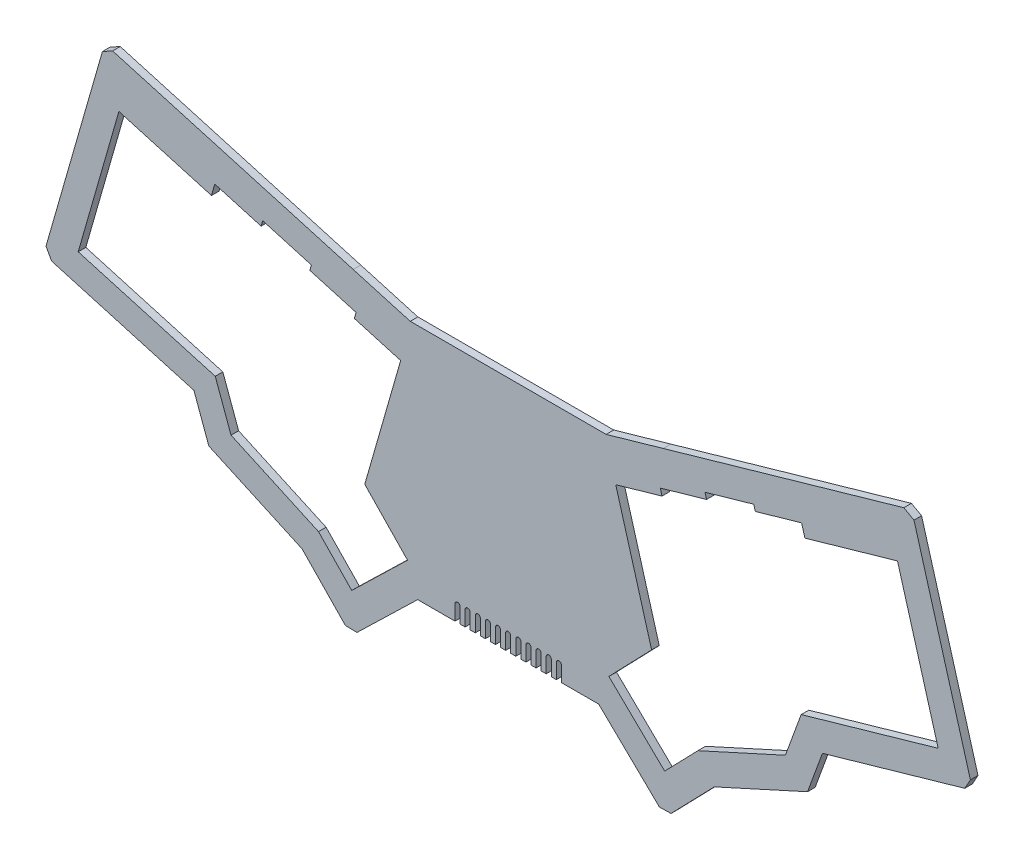
from build123d import *

# Parameters (mm, degrees)
BOSS_EXTRU_1_DEPTH      = 3
ENL_V_MAT_EXTRU_1_DEPTH = 10


with BuildPart() as part:
    # Esquisse1 → Boss.-Extru.1 (new body)
    with BuildSketch(Plane.XY):
        Polygon((-129.143746737, -14.701531345), (-206.446773007, -14.701531345), (-222.237416003, -10.173637327), (-228.962816583, -8.245159743), (-323.901077775, 18.972234266), (-327.912092601, 16.748746626), (-350.173506381, -60.88602933), (-347.950273, -64.896848521), (-291.80662177, -80.995781451), (-285.908889082, -97.08692424), (-249.107067355, -113.823629959), (-232.032352152, -131.457901649), (-227.449883961, -131.529994355), (-203.511236428, -108.350948678), (-132.079283315, -108.350948678), (-108.140635782, -131.529994355), (-103.558167591, -131.457901649), (-86.483452388, -113.823629959), (-49.681630661, -97.08692424), (-43.783897973, -80.995781451), (12.359753257, -64.896848521), (14.582986638, -60.88602933), (-7.678427142, 16.748746626), (-11.689441968, 18.972234266), (-106.627703159, -8.245159743), (-113.35310374, -10.173637327), align=None)
        Polygon((-128.0696158, -96.878899722), (-106.057456456, -118.225792128), (-92.935433745, -104.673746846), (-58.425639792, -88.979407851), (-52.188593581, -71.96249534), (1.870889973, -56.461187875), (-14.186085737, -0.463858857), (-50.716621092, -10.938821309), (-52.025991399, -6.372504389), (-70.291259076, -11.609985616), (-70.910965859, -9.448811229), (-90.137733677, -14.960840928), (-89.517720268, -17.123084647), (-107.782987945, -22.360565873), (-107.093845678, -24.763890567), (-125.358331696, -30.001147656), (-111.200088958, -79.377961929), (-127.377713529, -96.161100182), align=None, mode=Mode.SUBTRACT)
        Polygon((-224.390430785, -79.377961929), (-208.212806214, -96.161100182), (-207.491865187, -96.85509979), (-208.236606037, -97.572971364), (-229.533063287, -118.225792128), (-242.655085998, -104.673746846), (-277.164879951, -88.979407851), (-283.401926162, -71.96249534), (-337.461409717, -56.461187875), (-321.404434006, -0.463858857), (-284.873898651, -10.938821309), (-283.564528345, -6.372504389), (-265.299260667, -11.609985616), (-264.679553884, -9.448811229), (-245.452786066, -14.960840928), (-246.072799476, -17.123084647), (-227.807531798, -22.360565873), (-228.496674065, -24.763890567), (-210.232188047, -30.001147656), align=None, mode=Mode.SUBTRACT)
    extrude(amount=BOSS_EXTRU_1_DEPTH)

    # Esquisse2 → Enlèv. mat.-Extru.1 (cut)
    with BuildSketch(Plane.XY.offset(3)):
        with BuildLine():
            Line((-168.795259872, -108.350948678), (-168.795259872, -102.350948678))
            ThreePointArc((-168.795259872, -102.350948678), (-167.795259872, -101.350948678), (-166.795259872, -102.350948678))
            Line((-166.795259872, -102.350948678), (-166.795259872, -108.350948678))
            ThreePointArc((-166.795259872, -108.350948678), (-167.795259872, -109.350948678), (-168.795259872, -108.350948678))
        make_face()
        with BuildLine():
            Line((-164.795259872, -108.350948678), (-164.795259872, -102.350948678))
            ThreePointArc((-164.795259872, -102.350948678), (-163.795259872, -101.350948678), (-162.795259872, -102.350948678))
            Line((-162.795259872, -102.350948678), (-162.795259872, -108.350948678))
            ThreePointArc((-162.795259872, -108.350948678), (-163.795259872, -109.350948678), (-164.795259872, -108.350948678))
        make_face()
        with BuildLine():
            Line((-160.795259872, -108.350948678), (-160.795259872, -102.350948678))
            ThreePointArc((-160.795259872, -102.350948678), (-159.795259872, -101.350948678), (-158.795259872, -102.350948678))
            Line((-158.795259872, -102.350948678), (-158.795259872, -108.350948678))
            ThreePointArc((-158.795259872, -108.350948678), (-159.795259872, -109.350948678), (-160.795259872, -108.350948678))
        make_face()
        with BuildLine():
            Line((-156.795259872, -108.350948678), (-156.795259872, -102.350948678))
            ThreePointArc((-156.795259872, -102.350948678), (-155.795259872, -101.350948678), (-154.795259872, -102.350948678))
            Line((-154.795259872, -102.350948678), (-154.795259872, -108.350948678))
            ThreePointArc((-154.795259872, -108.350948678), (-155.795259872, -109.350948678), (-156.795259872, -108.350948678))
        make_face()
        with BuildLine():
            Line((-152.795259872, -108.350948678), (-152.795259872, -102.350948678))
            ThreePointArc((-152.795259872, -102.350948678), (-151.795259872, -101.350948678), (-150.795259872, -102.350948678))
            Line((-150.795259872, -102.350948678), (-150.795259872, -108.350948678))
            ThreePointArc((-150.795259872, -108.350948678), (-151.795259872, -109.350948678), (-152.795259872, -108.350948678))
        make_face()
        with BuildLine():
            Line((-148.795259872, -108.350948678), (-148.795259872, -102.350948678))
            ThreePointArc((-148.795259872, -102.350948678), (-147.795259872, -101.350948678), (-146.795259872, -102.350948678))
            Line((-146.795259872, -102.350948678), (-146.795259872, -108.350948678))
            ThreePointArc((-146.795259872, -108.350948678), (-147.795259872, -109.350948678), (-148.795259872, -108.350948678))
        make_face()
        with BuildLine():
            Line((-172.795259872, -108.350948678), (-172.795259872, -102.350948678))
            ThreePointArc((-172.795259872, -102.350948678), (-171.795259872, -101.350948678), (-170.795259872, -102.350948678))
            Line((-170.795259872, -102.350948678), (-170.795259872, -108.350948678))
            ThreePointArc((-170.795259872, -108.350948678), (-171.795259872, -109.350948678), (-172.795259872, -108.350948678))
        make_face()
        with BuildLine():
            Line((-176.795259872, -108.350948678), (-176.795259872, -102.350948678))
            ThreePointArc((-176.795259872, -102.350948678), (-175.795259872, -101.350948678), (-174.795259872, -102.350948678))
            Line((-174.795259872, -102.350948678), (-174.795259872, -108.350948678))
            ThreePointArc((-174.795259872, -108.350948678), (-175.795259872, -109.350948678), (-176.795259872, -108.350948678))
        make_face()
        with BuildLine():
            Line((-180.795259872, -108.350948678), (-180.795259872, -102.350948678))
            ThreePointArc((-180.795259872, -102.350948678), (-179.795259872, -101.350948678), (-178.795259872, -102.350948678))
            Line((-178.795259872, -102.350948678), (-178.795259872, -108.350948678))
            ThreePointArc((-178.795259872, -108.350948678), (-179.795259872, -109.350948678), (-180.795259872, -108.350948678))
        make_face()
        with BuildLine():
            Line((-184.795259872, -108.350948678), (-184.795259872, -102.350948678))
            ThreePointArc((-184.795259872, -102.350948678), (-183.795259872, -101.350948678), (-182.795259872, -102.350948678))
            Line((-182.795259872, -102.350948678), (-182.795259872, -108.350948678))
            ThreePointArc((-182.795259872, -108.350948678), (-183.795259872, -109.350948678), (-184.795259872, -108.350948678))
        make_face()
        with BuildLine():
            Line((-188.795259872, -108.350948678), (-188.795259872, -102.350948678))
            ThreePointArc((-188.795259872, -102.350948678), (-187.795259872, -101.350948678), (-186.795259872, -102.350948678))
            Line((-186.795259872, -102.350948678), (-186.795259872, -108.350948678))
            ThreePointArc((-186.795259872, -108.350948678), (-187.795259872, -109.350948678), (-188.795259872, -108.350948678))
        make_face()
    extrude(amount=-ENL_V_MAT_EXTRU_1_DEPTH, mode=Mode.SUBTRACT)


solid = part.part
